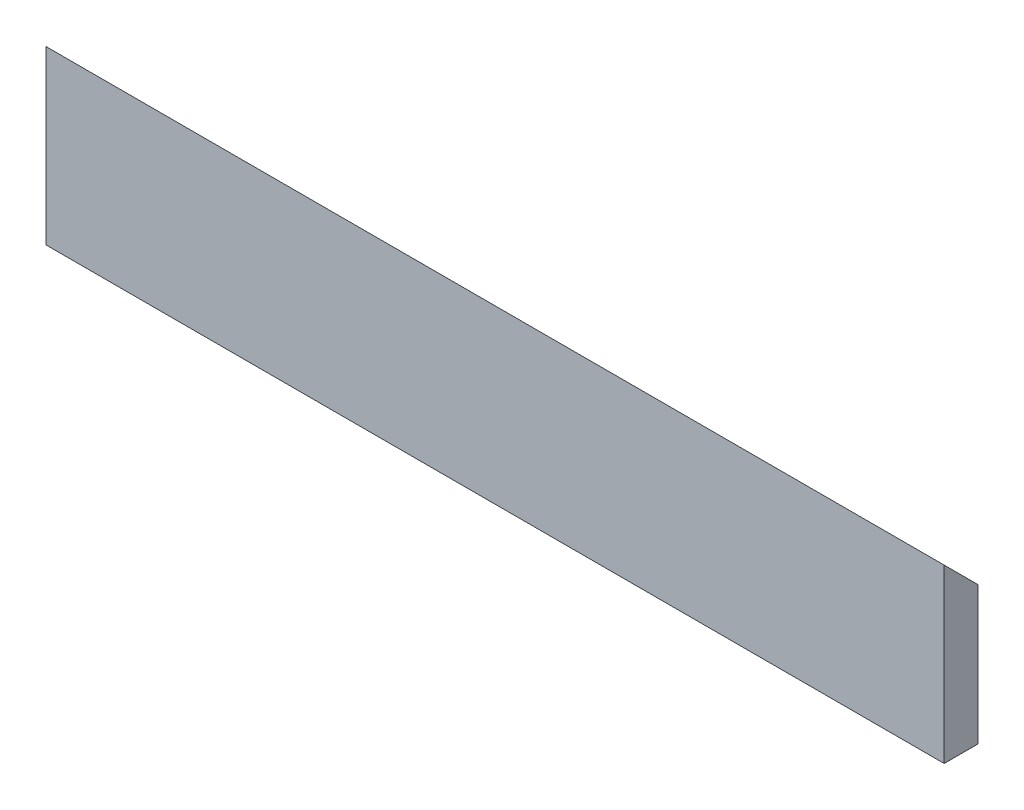
from build123d import *

# Parameters (mm, degrees)
EXTRUDE_1_DEPTH     = 15
CUT_EXTRUDE_START   = 76.2
SKETCH_6_R          = 1
CUT_EXTRUDE_1_DEPTH = 50.8
CUT_EXTRUDE_2_DEPTH = 406.800850172


with BuildPart() as part:
    # 草图1 → 凸台-拉伸1 (new body)
    with BuildSketch(Plane.XY):
        Polygon((0, 0), (322.1, 0), (398.3, 0), (398.3, 76.2), (322.1, 76.2), (0, 76.2), align=None)
    extrude(amount=EXTRUDE_1_DEPTH)

    # 草图6 → 切除-拉伸1 (cut)
    with BuildSketch(Plane(origin=(0, 0, 0), x_dir=(1, 0, 0), z_dir=(0, 1, 0)).offset(CUT_EXTRUDE_START)):
        with Locations(Location((157.514854478, -7.5, 0), (0, 0, 90))):
            Circle(SKETCH_6_R)
        with Locations(Location((195.614854478, -7.5, 0), (0, 0, 90))):
            Circle(SKETCH_6_R)
        with Locations(Location((233.714854478, -7.5, 0), (0, 0, 90))):
            Circle(SKETCH_6_R)
        with Locations(Location((271.814854478, -7.5, 0), (0, 0, 90))):
            Circle(SKETCH_6_R)
        with Locations(Location((119.414854478, -7.5, 0), (0, 0, 90))):
            Circle(SKETCH_6_R)
        with Locations(Location((81.314854478, -7.5, 0), (0, 0, 90))):
            Circle(SKETCH_6_R)
        with Locations(Location((43.214854478, -7.5, 0), (0, 0, 90))):
            Circle(SKETCH_6_R)
    extrude(amount=-CUT_EXTRUDE_1_DEPTH, mode=Mode.SUBTRACT)

    # 草图3 → 切除-拉伸2 (cut, through all)
    with BuildSketch(Plane.ZY):
        Polygon((0, 76.2), (15, 76.2), (0, 61.2), align=None)
    extrude(amount=-CUT_EXTRUDE_2_DEPTH, mode=Mode.SUBTRACT)


solid = part.part
